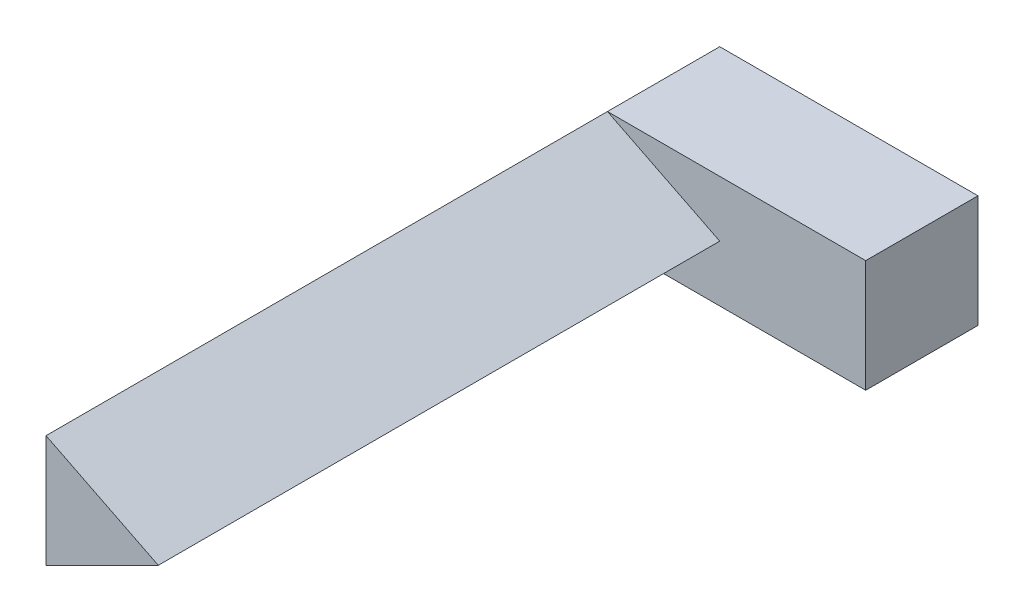
from build123d import *

# Parameters (mm, degrees)
BOSS_EXTRUDE1_DEPTH = 5
CUT_EXTRUDE1_DEPTH  = 50


with BuildPart() as part:
    # Sketch1 → Boss-Extrude1 (new, symmetric)
    with BuildSketch(Plane(origin=(0, 0, 0), x_dir=(1, 0, 0), z_dir=(0, 1, 0))):
        Polygon((0, 0), (-23, 0), (-23, -60), (-13, -60), (-13, -10), (0, -10), align=None)
    extrude(amount=BOSS_EXTRUDE1_DEPTH, both=True)

    # Sketch2 → Cut-Extrude1 (cut)
    with BuildSketch(Plane.XY.offset(60)):
        Polygon((-13, 5), (-23, 5), (-13, 0), align=None)
        Polygon((-13, -5), (-13, 0), (-23, -5), align=None)
    extrude(amount=-CUT_EXTRUDE1_DEPTH, mode=Mode.SUBTRACT)


solid = part.part
